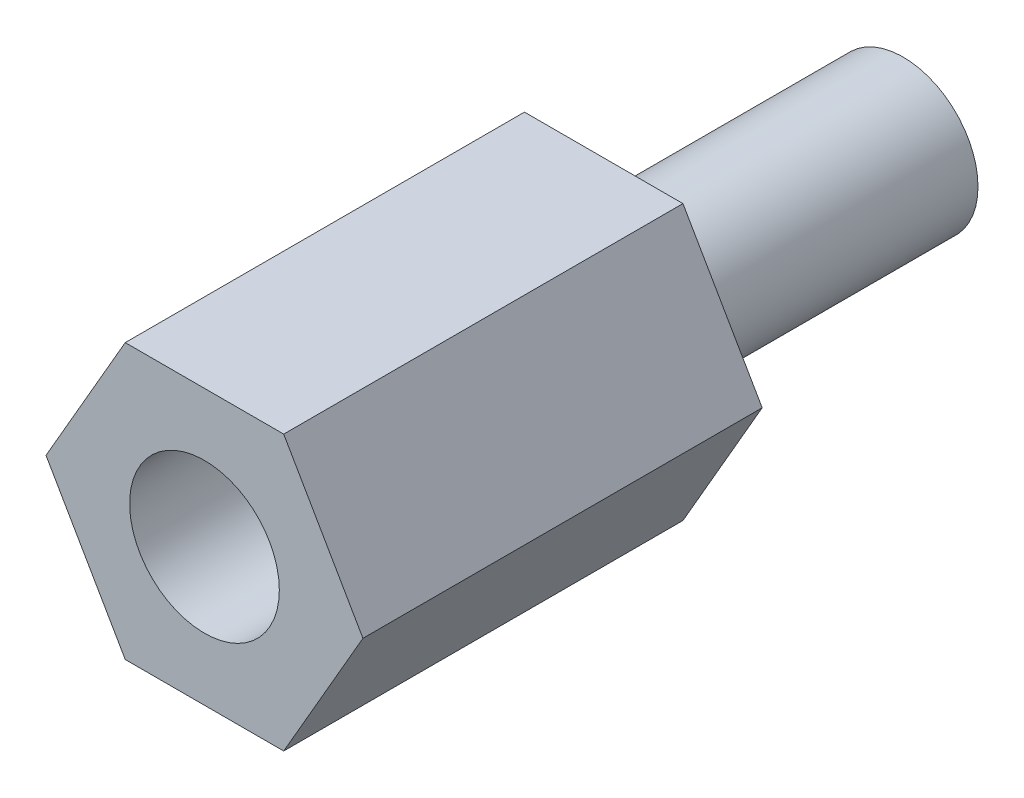
from build123d import *

# Parameters (mm, degrees)
BOSS_EXTRUDE1_DEPTH = 8
SKETCH1_3_R         = 1.5
BOSS_EXTRUDE2_DEPTH = 6
CUT_EXTRUDE1_START  = 8
SKETCH1_4_R         = 1.5
CUT_EXTRUDE1_DEPTH  = 6


with BuildPart() as part:
    # Sketch1 → Boss-Extrude1 (new body)
    with BuildSketch(Plane.XY):
        Polygon((1.58771324, -2.75), (3.175426481, 0), (1.58771324, 2.75), (-1.58771324, 2.75), (-3.175426481, 0), (-1.58771324, -2.75), align=None)
    extrude(amount=BOSS_EXTRUDE1_DEPTH)

    # Sketch1<3> → Boss-Extrude2 (add)
    with BuildSketch(Plane.XY):
        Circle(SKETCH1_3_R)
    extrude(amount=-BOSS_EXTRUDE2_DEPTH)

    # Sketch1<4> → Cut-Extrude1 (cut)
    with BuildSketch(Plane.XY.offset(CUT_EXTRUDE1_START)):
        Circle(SKETCH1_4_R)
    extrude(amount=-CUT_EXTRUDE1_DEPTH, mode=Mode.SUBTRACT)


solid = part.part
